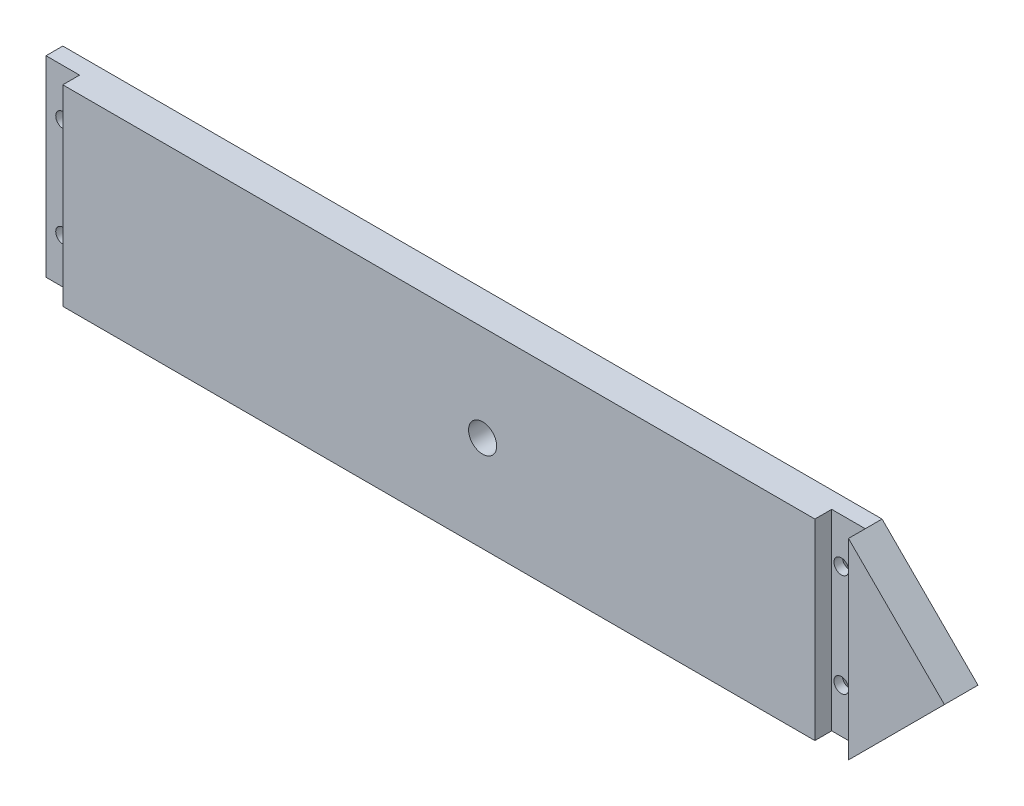
from build123d import *

# Parameters (mm, degrees)
SKETCH1_W                                         = 173.0375
SKETCH1_H                                         = 36.27882
EXTRUDE2_DEPTH                                    = 6.35
SKETCH8_W                                         = 6.35
SKETCH8_H                                         = 36.27882
EXTRUDE7_DEPTH                                    = 3.175
CSK_FOR_3_FLAT_HEAD_SOCKET_CAP_SCREW1_D           = 2.794
CSK_FOR_3_FLAT_HEAD_SOCKET_CAP_SCREW1_CSINK_D     = 5.51688
CSK_FOR_3_FLAT_HEAD_SOCKET_CAP_SCREW1_CSINK_ANGLE = 82
CSK_FOR_3_FLAT_HEAD_SOCKET_CAP_SCREW2_D           = 2.794
CSK_FOR_3_FLAT_HEAD_SOCKET_CAP_SCREW2_CSINK_D     = 5.51688
CSK_FOR_3_FLAT_HEAD_SOCKET_CAP_SCREW2_CSINK_ANGLE = 82
CSK_FOR_3_FLAT_HEAD_SOCKET_CAP_SCREW3_D           = 2.794
CSK_FOR_3_FLAT_HEAD_SOCKET_CAP_SCREW3_CSINK_D     = 5.51688
CSK_FOR_3_FLAT_HEAD_SOCKET_CAP_SCREW3_CSINK_ANGLE = 82
EXTRUDE8_DEPTH                                    = 89.627618702
SKETCH19_R                                        = 2.656568676
EXTRUDE9_DEPTH                                    = 89.627618702


with BuildPart() as part:
    # Sketch1 → Extrude2 (new body)
    with BuildSketch(Plane.XY):
        Rectangle(SKETCH1_W, SKETCH1_H)
    extrude(amount=EXTRUDE2_DEPTH)

    # Sketch8 → Extrude7 (cut)
    with BuildSketch(Plane.XY.offset(6.35)):
        with Locations((-83.34375, 0)):
            Rectangle(SKETCH8_W, SKETCH8_H)
        with Locations((65.20561, 0)):
            Rectangle(SKETCH8_W, SKETCH8_H)
    extrude(amount=-EXTRUDE7_DEPTH, mode=Mode.SUBTRACT)

    # CSK for #3 Flat Head Socket Cap Screw1 (through all)
    with Locations(Plane(origin=(-27.747731188, -5.395978674, 0), x_dir=(-1, 0, 0), z_dir=(0, 0, -1))):
        with Locations((55.533788812, -4.331019161)):
            CounterSinkHole(CSK_FOR_3_FLAT_HEAD_SOCKET_CAP_SCREW1_D / 2, CSK_FOR_3_FLAT_HEAD_SOCKET_CAP_SCREW1_CSINK_D / 2, counter_sink_angle=CSK_FOR_3_FLAT_HEAD_SOCKET_CAP_SCREW1_CSINK_ANGLE)

    # CSK for #3 Flat Head Socket Cap Screw2 (through all)
    with Locations(Plane(origin=(-27.747731188, -5.395978674, 0), x_dir=(-1, 0, 0), z_dir=(0, 0, -1))):
        with Locations((55.533788812, 14.608526561)):
            CounterSinkHole(CSK_FOR_3_FLAT_HEAD_SOCKET_CAP_SCREW2_D / 2, CSK_FOR_3_FLAT_HEAD_SOCKET_CAP_SCREW2_CSINK_D / 2, counter_sink_angle=CSK_FOR_3_FLAT_HEAD_SOCKET_CAP_SCREW2_CSINK_ANGLE)

    # CSK for #3 Flat Head Socket Cap Screw3 (through all)
    with Locations(Plane(origin=(-27.747731188, -5.395978674, 0), x_dir=(-1, 0, 0), z_dir=(0, 0, -1))):
        with Locations((-91.600791188, -4.318251326), (-91.600791188, 15.110208674)):
            CounterSinkHole(CSK_FOR_3_FLAT_HEAD_SOCKET_CAP_SCREW3_D / 2, CSK_FOR_3_FLAT_HEAD_SOCKET_CAP_SCREW3_CSINK_D / 2, counter_sink_angle=CSK_FOR_3_FLAT_HEAD_SOCKET_CAP_SCREW3_CSINK_ANGLE)

    # Sketch18 → Extrude8 (cut, through all)
    with BuildSketch(Plane.XY.offset(6.35)):
        Polygon((86.51875, 0), (68.38061, 18.13941), (113.519162523, 18.13941), (113.519162523, -18.13941), (68.38061, -18.13941), align=None)
    extrude(amount=-EXTRUDE8_DEPTH, mode=Mode.SUBTRACT)

    # Sketch19 → Extrude9 (cut, through all)
    with BuildSketch(Plane.XY.offset(6.35)):
        with Locations((-0.79375, 0)):
            Circle(SKETCH19_R)
    extrude(amount=-EXTRUDE9_DEPTH, mode=Mode.SUBTRACT)


solid = part.part
